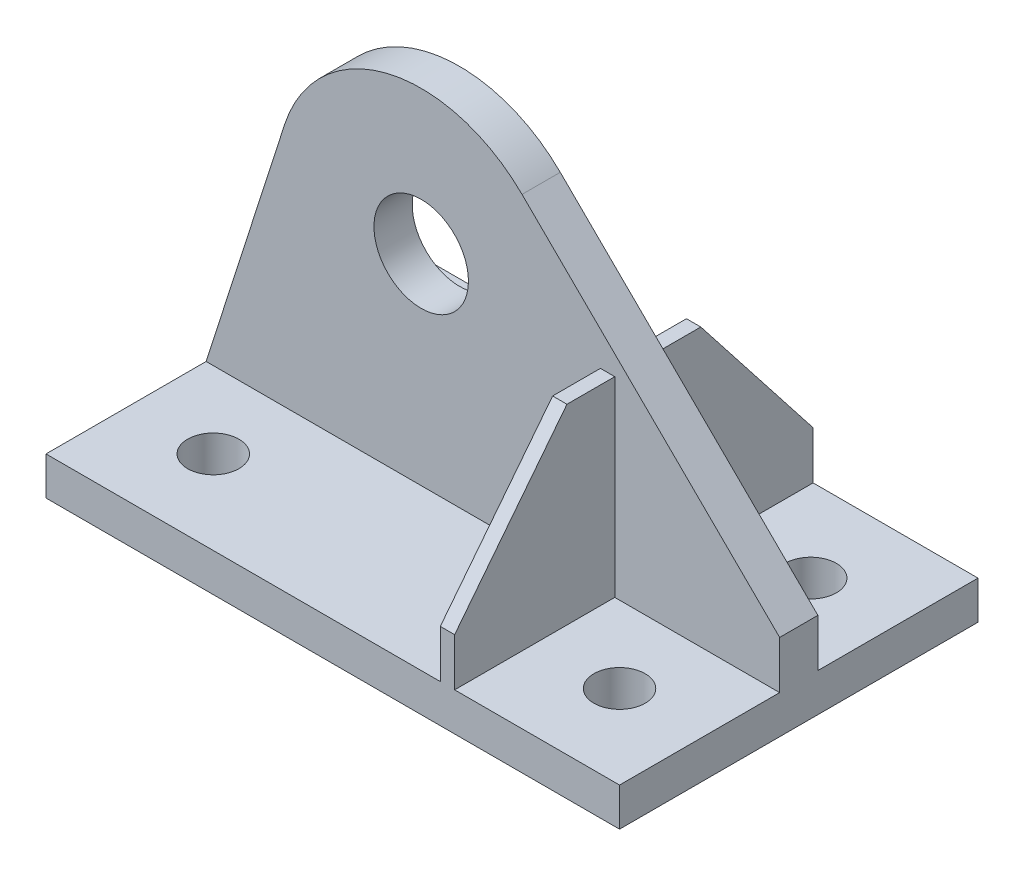
from build123d import *

# Parameters (mm, degrees)
SKETCH_1_W                  = 240
SKETCH_1_H                  = 150
EXTRUDE_1_DEPTH             = 16
SKETCH_2_R                  = 10.728301902
CUT_EXTRUDE_1_DEPTH         = 284.471338939
PATTERN_LINEAR_1_COUNT      = 2
PATTERN_LINEAR_1_PITCH      = 170
PATTERN_LINEAR_1_COUNT_DIR2 = 2
PATTERN_LINEAR_1_PITCH_DIR2 = 80
SKETCH_3_W                  = 6
SKETCH_3_H                  = 150
EXTRUDE_2_DEPTH             = 80
CUT_EXTRUDE_2_DEPTH         = 243.777676074
SKETCH_7_W                  = 240
SKETCH_7_H                  = 16
EXTRUDE_3_DEPTH             = 144
CUT_EXTRUDE_4_DEPTH         = 301.14829668
CUT_EXTRUDE_5_DEPTH         = 301.14829668
SKETCH_15_R                 = 19.766227273
CUT_EXTRUDE_6_DEPTH         = 301.14829668


with BuildPart() as part:
    # 草图1 → 凸台-拉伸1 (new body)
    with BuildSketch(Plane(origin=(0, 0, 0), x_dir=(1, 0, 0), z_dir=(0, 1, 0))):
        with Locations((120, 75)):
            Rectangle(SKETCH_1_W, SKETCH_1_H)
    extrude(amount=EXTRUDE_1_DEPTH)

    # 草图2 → 切除-拉伸1 (cut, through all)
    with BuildSketch(Plane(origin=(0, 16, 0), x_dir=(1, 0, 0), z_dir=(0, 1, 0))):
        with Locations(Location((35, 35, 0), (0, 0, 270))):
            Circle(SKETCH_2_R)
    cut_extrude_1 = extrude(amount=-CUT_EXTRUDE_1_DEPTH, mode=Mode.SUBTRACT)

    # 阵列(线性)1: Cut-Extrude 1 2 × 2
    with Locations(*[(i * PATTERN_LINEAR_1_PITCH, 0, -j * PATTERN_LINEAR_1_PITCH_DIR2) for i in range(PATTERN_LINEAR_1_COUNT) for j in range(PATTERN_LINEAR_1_COUNT_DIR2) if (i, j) != (0, 0)]):
        add(cut_extrude_1, mode=Mode.SUBTRACT)

    # 草图3 → 凸台-拉伸2 (add)
    with BuildSketch(Plane(origin=(0, 16, 0), x_dir=(1, 0, 0), z_dir=(0, 1, 0))):
        with Locations((168, 75)):
            Rectangle(SKETCH_3_W, SKETCH_3_H)
    extrude(amount=EXTRUDE_2_DEPTH)

    # 草图4 → 切除-拉伸2 (cut, through all)
    with BuildSketch(Plane.ZY.offset(-165)):
        Polygon((0, 96), (-47, 96), (0, 36), align=None)
        Polygon((-150, 96), (-103, 96), (-150, 36), align=None)
    extrude(amount=-CUT_EXTRUDE_2_DEPTH, mode=Mode.SUBTRACT)

    # 草图7 → 凸台-拉伸3 (add)
    with BuildSketch(Plane(origin=(0, 16, 0), x_dir=(1, 0, 0), z_dir=(0, 1, 0))):
        with Locations((120, 75)):
            Rectangle(SKETCH_7_W, SKETCH_7_H)
    extrude(amount=EXTRUDE_3_DEPTH)

    # 草图12 → 切除-拉伸4 (cut, through all)
    with BuildSketch(Plane.XY.offset(-67)):
        with BuildLine():
            Line((32.874495942, 118.348754348), (0, 16))
            Line((0, 16), (0, 160))
            Line((0, 160), (90, 160))
            ThreePointArc((90, 160), (54.651204129, 148.481570008), (32.874495942, 118.348754348))
        make_face()
    extrude(amount=-CUT_EXTRUDE_4_DEPTH, mode=Mode.SUBTRACT)

    # 草图14 → 切除-拉伸5 (cut, through all)
    with BuildSketch(Plane.XY.offset(-67)):
        with BuildLine():
            Line((132.198608493, 142.652988656), (240, 36))
            Line((240, 36), (240, 160))
            Line((240, 160), (90, 160))
            ThreePointArc((90, 160), (112.812504035, 155.494050669), (132.198608493, 142.652988656))
        make_face()
    extrude(amount=-CUT_EXTRUDE_5_DEPTH, mode=Mode.SUBTRACT)

    # 草图15 → 切除-拉伸6 (cut, through all)
    with BuildSketch(Plane.XY.offset(-67)):
        with Locations((90, 100)):
            Circle(SKETCH_15_R)
    extrude(amount=-CUT_EXTRUDE_6_DEPTH, mode=Mode.SUBTRACT)


solid = part.part
